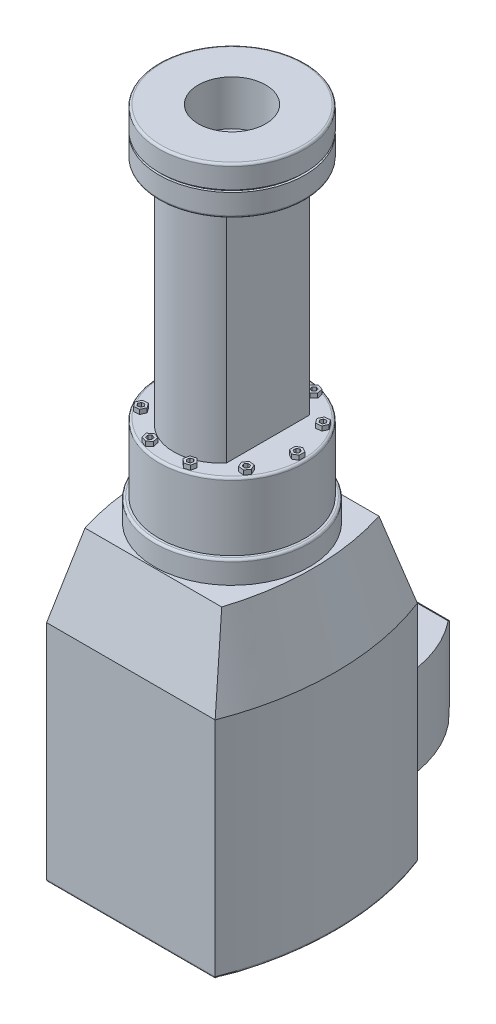
from build123d import *

# Parameters (mm, degrees)
BOSS_EXTRUDE1_DEPTH  = 100
SKETCH4_R            = 34.5
BOSS_EXTRUDE2_DEPTH  = 10
SKETCH5_R            = 32.5
BOSS_EXTRUDE3_DEPTH  = 30
BOSS_EXTRUDE4_DEPTH  = 2
CIRPATTERN1_COUNT    = 10
BOSS_EXTRUDE5_DEPTH  = 100
SKETCH8_R            = 32.5
BOSS_EXTRUDE6_DEPTH  = 10
SKETCH9_R            = 31.5
BOSS_EXTRUDE7_DEPTH  = 1
SKETCH10_R           = 32.5
BOSS_EXTRUDE8_DEPTH  = 10
SKETCH11_R           = 42.5
BOSS_EXTRUDE9_DEPTH  = 10.5
BOSS_EXTRUDE10_DEPTH = 35
BOSS_EXTRUDE11_DEPTH = 20
CUT_EXTRUDE1_DEPTH   = 314.700892617
FILLET1_R            = 1
FILLET2_R            = 1
SKETCH15_R           = 15
CUT_EXTRUDE2_DEPTH   = 20
SKETCH16_R           = 15
CUT_EXTRUDE3_DEPTH   = 20


with BuildPart() as part:
    # Sketch1 → Boss-Extrude1 (new body)
    with BuildSketch(Plane(origin=(0, 0, 0), x_dir=(1, 0, 0), z_dir=(0, 1, 0))):
        with BuildLine():
            Line((37.5, 45), (-37.5, 45))
            ThreePointArc((-37.5, 45), (-45.880962103, 0), (-37.5, -45))
            Line((-37.5, -45), (37.5, -45))
            ThreePointArc((37.5, -45), (45.880962103, 0), (37.5, 45))
        make_face()
    extrude(amount=BOSS_EXTRUDE1_DEPTH)

    # Sketch2 for Loft1 → Loft1 section 0
    with BuildSketch(Plane(origin=(0, 100, 0), x_dir=(1, 0, 0), z_dir=(0, 1, 0))):
        with BuildLine():
            Line((-37.5, -45), (37.5, -45))
            # circular arc as an exact rational Bezier (weights 1, cos(half-angle), 1)
            Bezier((37.5, -45), (54.864231746, 0), (37.5, 45), weights=[1, 0.932952303, 1])
            Line((37.5, 45), (-37.5, 45))
            Bezier((-37.5, 45), (-54.864231746, 0), (-37.5, -45), weights=[1, 0.932952303, 1])
        make_face()
    # Sketch3 for Loft1 → Loft1 section 1
    with BuildSketch(Plane(origin=(0, 135, 0), x_dir=(1, 0, 0), z_dir=(0, 1, 0))):
        with BuildLine():
            Line((30.425473604, 35), (-30.425473604, 35))
            Bezier((-30.425473604, 35), (-41.608142487, 0), (-30.425473604, -35), weights=[1, 0.95256097, 1])
            Line((-30.425473604, -35), (30.425473604, -35))
            Bezier((30.425473604, -35), (41.608142487, 0), (30.425473604, 35), weights=[1, 0.95256097, 1])
        make_face()
    loft()

    # Sketch4 → Boss-Extrude2 (add)
    with BuildSketch(Plane(origin=(0, 135, 0), x_dir=(1, 0, 0), z_dir=(0, 1, 0))):
        with Locations(Location((0, 0, 0), (0, 0, 270))):
            Circle(SKETCH4_R)
    extrude(amount=BOSS_EXTRUDE2_DEPTH)

    # Sketch5 → Boss-Extrude3 (add)
    with BuildSketch(Plane(origin=(0, 145, 0), x_dir=(1, 0, 0), z_dir=(0, 1, 0))):
        with Locations(Location((0, 0, 0), (0, 0, 270))):
            Circle(SKETCH5_R)
    extrude(amount=BOSS_EXTRUDE3_DEPTH)

    # Sketch6 → Boss-Extrude4 (add)
    with BuildSketch(Plane(origin=(0, 175, 0), x_dir=(1, 0, 0), z_dir=(0, 1, 0))):
        Polygon((29, 2.5), (26.834936491, 1.25), (26.834936491, -1.25), (29, -2.5), (31.165063509, -1.25), (31.165063509, 1.25), align=None)
        Polygon((27.834936491, -0.672649731), (29, -1.345299462), (30.165063509, -0.672649731), (30.165063509, 0.672649731), (29, 1.345299462), (27.834936491, 0.672649731), align=None, mode=Mode.SUBTRACT)
    boss_extrude4 = extrude(amount=BOSS_EXTRUDE4_DEPTH)

    # CirPattern1: Boss-Extrude4 ×10 about axis
    cirpattern1_axis = Axis((0, 0, 0), (0, 1, 0))
    for i in range(1, CIRPATTERN1_COUNT):
        add(boss_extrude4.rotate(cirpattern1_axis, i * 360 / CIRPATTERN1_COUNT))

    # Sketch7 → Boss-Extrude5 (add)
    with BuildSketch(Plane(origin=(0, 175, 0), x_dir=(1, 0, 0), z_dir=(0, 1, 0))):
        with BuildLine():
            Line((16, -18.5), (16, 18.5))
            ThreePointArc((16, 18.5), (0, 25.898529491), (-16, 18.5))
            Line((-16, 18.5), (-16, -18.5))
            ThreePointArc((-16, -18.5), (0, -25.898529491), (16, -18.5))
        make_face()
    extrude(amount=BOSS_EXTRUDE5_DEPTH)

    # Sketch8 → Boss-Extrude6 (add)
    with BuildSketch(Plane(origin=(0, 275, 0), x_dir=(1, 0, 0), z_dir=(0, 1, 0))):
        with Locations(Location((0, 0, 0), (0, 0, 270))):
            Circle(SKETCH8_R)
    extrude(amount=BOSS_EXTRUDE6_DEPTH)

    # Sketch9 → Boss-Extrude7 (add)
    with BuildSketch(Plane(origin=(0, 285, 0), x_dir=(1, 0, 0), z_dir=(0, 1, 0))):
        with Locations(Location((0, 0, 0), (0, 0, 270))):
            Circle(SKETCH9_R)
    extrude(amount=BOSS_EXTRUDE7_DEPTH)

    # Sketch10 → Boss-Extrude8 (add)
    with BuildSketch(Plane(origin=(0, 286, 0), x_dir=(1, 0, 0), z_dir=(0, 1, 0))):
        with Locations(Location((0, 0, 0), (0, 0, 270))):
            Circle(SKETCH10_R)
    extrude(amount=BOSS_EXTRUDE8_DEPTH)

    # Sketch11 → Boss-Extrude9 (add, symmetric)
    with BuildSketch(Plane(origin=(-37.5, 0, 0), x_dir=(0, 0, -1), z_dir=(1, 0, 0))):
        with Locations(Location((45, 50, 0), (0, 0, 90))):
            Circle(SKETCH11_R)
    extrude(amount=BOSS_EXTRUDE9_DEPTH, both=True)

    # Sketch12 → Boss-Extrude10 (add)
    with BuildSketch(Plane(origin=(-27, 0, 0), x_dir=(0, 0, -1), z_dir=(1, 0, 0))):
        with BuildLine():
            Line((45, 70), (75, 70))
            ThreePointArc((75, 70), (85.128852225, 50), (75, 30))
            Line((75, 30), (45, 30))
            Line((45, 30), (45, 70))
        make_face()
    extrude(amount=BOSS_EXTRUDE10_DEPTH)

    # Sketch13 → Boss-Extrude11 (add, symmetric)
    with BuildSketch(Plane(origin=(0, 50, 0), x_dir=(1, 0, 0), z_dir=(0, 1, 0))):
        with BuildLine():
            Line((33, 45), (8, 45))
            Line((8, 45), (8, 87))
            ThreePointArc((8, 87), (25.421855105, 68.929675658), (33, 45))
        make_face()
    extrude(amount=BOSS_EXTRUDE11_DEPTH, both=True)

    # Sketch14 → Cut-Extrude1 (cut, through all)
    with BuildSketch(Plane.ZY.offset(-8)):
        with BuildLine():
            Line((-87, 30), (-75, 30))
            ThreePointArc((-75, 30), (-85.128852225, 50), (-75, 70))
            Line((-75, 70), (-87, 70))
            Line((-87, 70), (-87, 30))
        make_face()
    extrude(amount=-CUT_EXTRUDE1_DEPTH, mode=Mode.SUBTRACT)

    # Fillet1
    fillet1_edges = [part.edges().sort_by_distance(p)[0] for p in [
        (0, 145, -34.5),
        (0, 275, -32.5),
        (0, 175, -32.5),
        (0, 296, -32.5),
        (0, 0, -45),
        (45.880962103, 0, 0),
        (0, 0, 45),
        (-45.880962103, 0, 0),
    ]]
    fillet(fillet1_edges, radius=FILLET1_R)

    # Fillet2
    fillet2_edges = [part.edges().sort_by_distance(p)[0] for p in [
        (-48, 7.5, -45),
        (-27, 50, -87.5),
    ]]
    fillet(fillet2_edges, radius=FILLET2_R)

    # Sketch15 → Cut-Extrude2 (cut)
    with BuildSketch(Plane(origin=(0, 296, 0), x_dir=(1, 0, 0), z_dir=(0, 1, 0))):
        with Locations(Location((0, 0, 0), (0, 0, 270))):
            Circle(SKETCH15_R)
    extrude(amount=-CUT_EXTRUDE2_DEPTH, mode=Mode.SUBTRACT)

    # Sketch16 → Cut-Extrude3 (cut)
    with BuildSketch(Plane.ZY.offset(48)):
        with Locations((-45, 50)):
            Circle(SKETCH16_R)
    extrude(amount=-CUT_EXTRUDE3_DEPTH, mode=Mode.SUBTRACT)


solid = part.part
